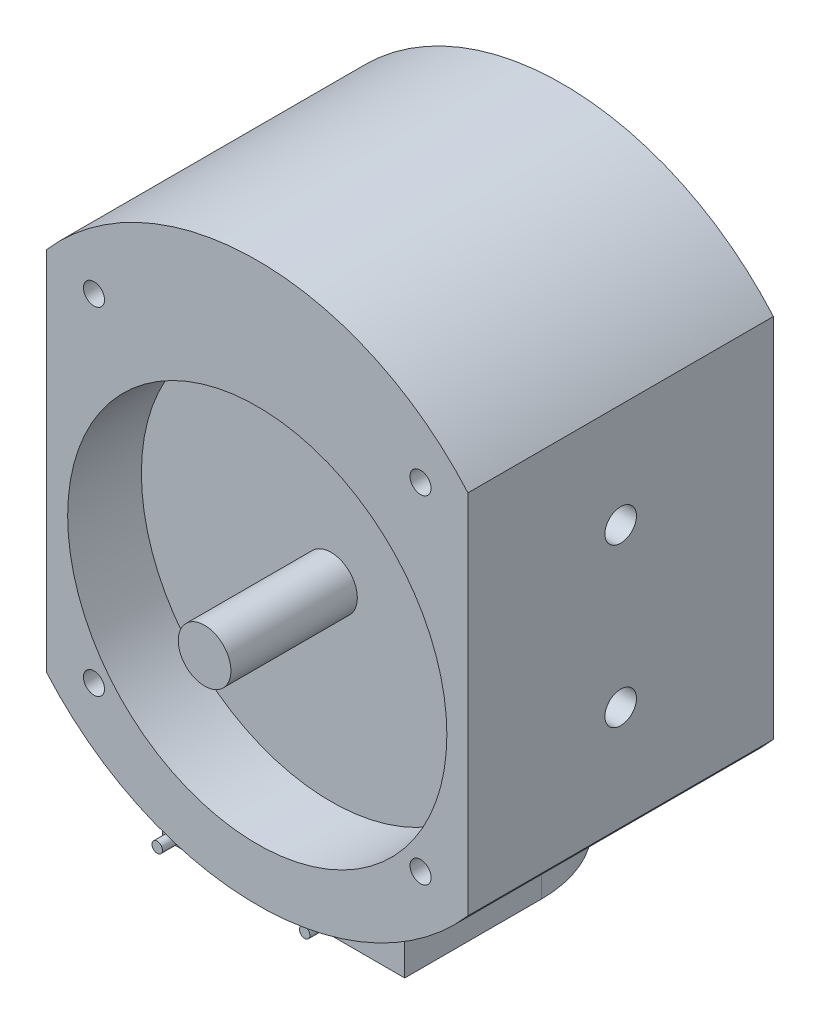
from build123d import *

# Parameters (mm, degrees)
BOSS_EXTRUDE1_DEPTH      = 14.5
BOSS_EXTRUDE2_REACH      = 65.963
BOSS_EXTRUDE2_END_RADIUS = 26.5
SKETCH4_R                = 0.5
BOSS_EXTRUDE3_DEPTH      = 5
SKETCH6_R                = 2.5
BOSS_EXTRUDE4_DEPTH      = 19.5
SKETCH7_R                = 18
SKETCH7_R_2              = 2.5
CUT_EXTRUDE1_DEPTH       = 7
SKETCH8_R                = 1
CUT_EXTRUDE2_DEPTH       = 50.558046814
SKETCH9_R                = 1.5
CUT_EXTRUDE3_DEPTH       = 5


with BuildPart() as part:
    # Sketch1 → Boss-Extrude1 (new, symmetric)
    with BuildSketch(Plane.XY):
        with BuildLine():
            Line((-20, 20.885338651), (-20, -13.885338651))
            ThreePointArc((-20, -13.885338651), (0, -23), (20, -13.885338651))
            Line((20, -13.885338651), (20, 20.885338651))
            ThreePointArc((20, 20.885338651), (0, 30), (-20, 20.885338651))
        make_face()
    extrude(amount=BOSS_EXTRUDE1_DEPTH, both=True)

    # Boss-Extrude2: up to this cylinder (the profile starts outside it)
    boss_extrude2_end = Plane(origin=(0, 3.5, -3.065471), z_dir=(0, 0, -1)) * Cylinder(BOSS_EXTRUDE2_END_RADIUS, 185.926, mode=Mode.PRIVATE)
    # Sketch3 → Boss-Extrude2 (add, up to the surface)
    with BuildSketch(Plane(origin=(0, -29, 0), x_dir=(1, 0, 0), z_dir=(0, 1, 0)), mode=Mode.PRIVATE) as boss_extrude2_sk1:
        with BuildLine():
            Line((-11.658910532, 14.5), (2.658910532, 14.5))
            ThreePointArc((2.658910532, 14.5), (5.85802759, 10.496124943), (7, 5.5))
            Line((7, 5.5), (7, -7.5))
            Line((7, -7.5), (-16, -7.5))
            Line((-16, -7.5), (-16, 5.5))
            ThreePointArc((-16, 5.5), (-14.85802759, 10.496124943), (-11.658910532, 14.5))
        make_face()
    boss_extrude2_tool1 = extrude(boss_extrude2_sk1.sketch, amount=BOSS_EXTRUDE2_REACH, mode=Mode.PRIVATE) - boss_extrude2_end
    add(boss_extrude2_tool1.solids().sort_by_distance((-4.5, -29, -3.065471))[0])

    # Sketch4 → Boss-Extrude3 (add)
    with BuildSketch(Plane.XY.offset(7.5)):
        with Locations(Location((-11.5, -25, 0), (0, 0, 180))):
            Circle(SKETCH4_R)
        with Locations(Location((2.5, -25, 0), (0, 0, 180))):
            Circle(SKETCH4_R)
    extrude(amount=BOSS_EXTRUDE3_DEPTH)

    # Sketch6 → Boss-Extrude4 (add, symmetric)
    with BuildSketch(Plane.XY):
        Circle(SKETCH6_R)
    extrude(amount=BOSS_EXTRUDE4_DEPTH, both=True)

    # Sketch7 → Cut-Extrude1 (cut)
    with BuildSketch(Plane.XY.offset(14.5)):
        Circle(SKETCH7_R)
        Circle(SKETCH7_R_2, mode=Mode.SUBTRACT)
    extrude(amount=-CUT_EXTRUDE1_DEPTH, mode=Mode.SUBTRACT)

    # Sketch8 → Cut-Extrude2 (cut, through all)
    with BuildSketch(Plane.XY.offset(14.5)):
        with Locations((-15.5, 19.5)):
            Circle(SKETCH8_R)
        with Locations((15.5, 19.5)):
            Circle(SKETCH8_R)
        with Locations((15.5, -12.5)):
            Circle(SKETCH8_R)
        with Locations((-15.5, -12.5)):
            Circle(SKETCH8_R)
    extrude(amount=-CUT_EXTRUDE2_DEPTH, mode=Mode.SUBTRACT)

    # Sketch9 → Cut-Extrude3 (cut)
    with BuildSketch(Plane(origin=(20, 0, 0), x_dir=(0, 0, -1), z_dir=(1, 0, 0))):
        with Locations(Location((0, 11, 0), (0, 0, 90))):
            Circle(SKETCH9_R)
        with Locations(Location((0, -4, 0), (0, 0, 90))):
            Circle(SKETCH9_R)
    cut_extrude3 = extrude(amount=-CUT_EXTRUDE3_DEPTH, mode=Mode.SUBTRACT)

    # Mirror1: Cut-Extrude3 across plane
    add(cut_extrude3.mirror(Plane(origin=(0, 0, 0), x_dir=(0, 0, 1), z_dir=(1, 0, 0))), mode=Mode.SUBTRACT)


solid = part.part
